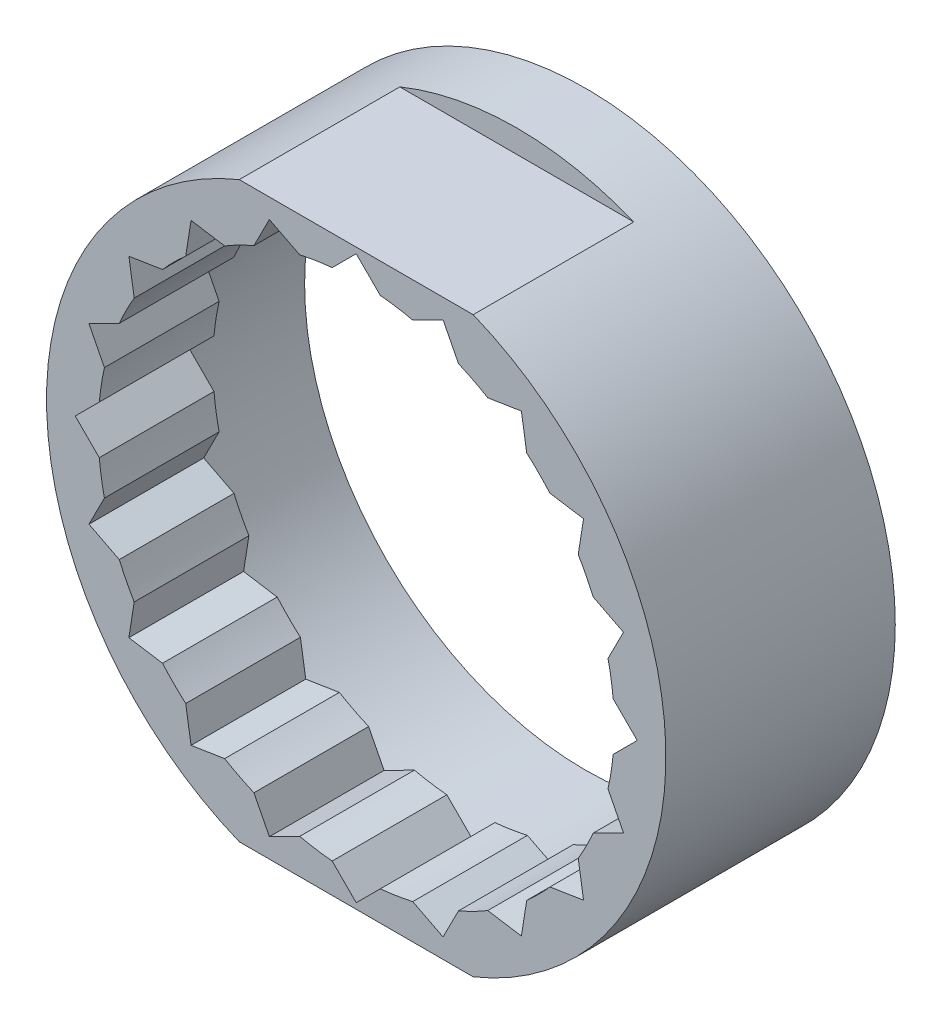
from build123d import *

# Parameters (mm, degrees)
SKETCH1_R      = 27
RING_DEPTH     = 20
SKETCH2_W      = 58
SKETCH2_H      = 4
FLATS_DEPTH    = 14
SKETCH3_R      = 22.5
BORE_DEPTH     = 20
SKETCH4_R      = 24.5
BORE_LOW_DEPTH = 10
TEETH_DEPTH    = 10


with BuildPart() as part:
    # Sketch1 → Ring (new body)
    with BuildSketch(Plane.XY):
        Circle(SKETCH1_R)
    extrude(amount=RING_DEPTH)

    # Sketch2 → Flats (cut)
    with BuildSketch(Plane.XY.offset(6)):
        with Locations((0, 27)):
            Rectangle(SKETCH2_W, SKETCH2_H)
        with Locations((0, -27)):
            Rectangle(SKETCH2_W, SKETCH2_H)
    extrude(amount=FLATS_DEPTH, mode=Mode.SUBTRACT)

    # Sketch3 → Bore (cut)
    with BuildSketch(Plane.XY):
        Circle(SKETCH3_R)
    extrude(amount=BORE_DEPTH, mode=Mode.SUBTRACT)

    # Sketch4 → Bore_low (cut)
    with BuildSketch(Plane.XY):
        Circle(SKETCH4_R)
    extrude(amount=BORE_LOW_DEPTH, mode=Mode.SUBTRACT)

    # Sketch5 → Teeth (cut)
    with BuildSketch(Plane.XY.offset(10)):
        Polygon((24.5, 0), (21.5, 3), (21.5, -3), align=None)
        Polygon((23.300884649, 7.570916362), (19.520664117, 9.497034928), (21.374766083, 3.79069583), align=None)
        Polygon((19.820916362, 14.400738681), (15.630509622, 15.064433907), (19.157221136, 10.210331941), align=None)
        Polygon((14.400738681, 19.820916362), (10.210331941, 19.157221136), (15.064433907, 15.630509622), align=None)
        Polygon((7.570916362, 23.300884649), (3.79069583, 21.374766083), (9.497034928, 19.520664117), align=None)
        Polygon((0, 24.5), (-3, 21.5), (3, 21.5), align=None)
        Polygon((-7.570916362, 23.300884649), (-9.497034928, 19.520664117), (-3.79069583, 21.374766083), align=None)
        Polygon((-14.400738681, 19.820916362), (-15.064433907, 15.630509622), (-10.210331941, 19.157221136), align=None)
        Polygon((-19.820916362, 14.400738681), (-19.157221136, 10.210331941), (-15.630509622, 15.064433907), align=None)
        Polygon((-23.300884649, 7.570916362), (-21.374766083, 3.79069583), (-19.520664117, 9.497034928), align=None)
        Polygon((-24.5, 0), (-21.5, -3), (-21.5, 3), align=None)
        Polygon((-23.300884649, -7.570916362), (-19.520664117, -9.497034928), (-21.374766083, -3.79069583), align=None)
        Polygon((-19.820916362, -14.400738681), (-15.630509622, -15.064433907), (-19.157221136, -10.210331941), align=None)
        Polygon((-14.400738681, -19.820916362), (-10.210331941, -19.157221136), (-15.064433907, -15.630509622), align=None)
        Polygon((-7.570916362, -23.300884649), (-3.79069583, -21.374766083), (-9.497034928, -19.520664117), align=None)
        Polygon((0, -24.5), (3, -21.5), (-3, -21.5), align=None)
        Polygon((7.570916362, -23.300884649), (9.497034928, -19.520664117), (3.79069583, -21.374766083), align=None)
        Polygon((14.400738681, -19.820916362), (15.064433907, -15.630509622), (10.210331941, -19.157221136), align=None)
        Polygon((19.820916362, -14.400738681), (19.157221136, -10.210331941), (15.630509622, -15.064433907), align=None)
        Polygon((23.300884649, -7.570916362), (21.374766083, -3.79069583), (19.520664117, -9.497034928), align=None)
    extrude(amount=TEETH_DEPTH, mode=Mode.SUBTRACT)


solid = part.part
